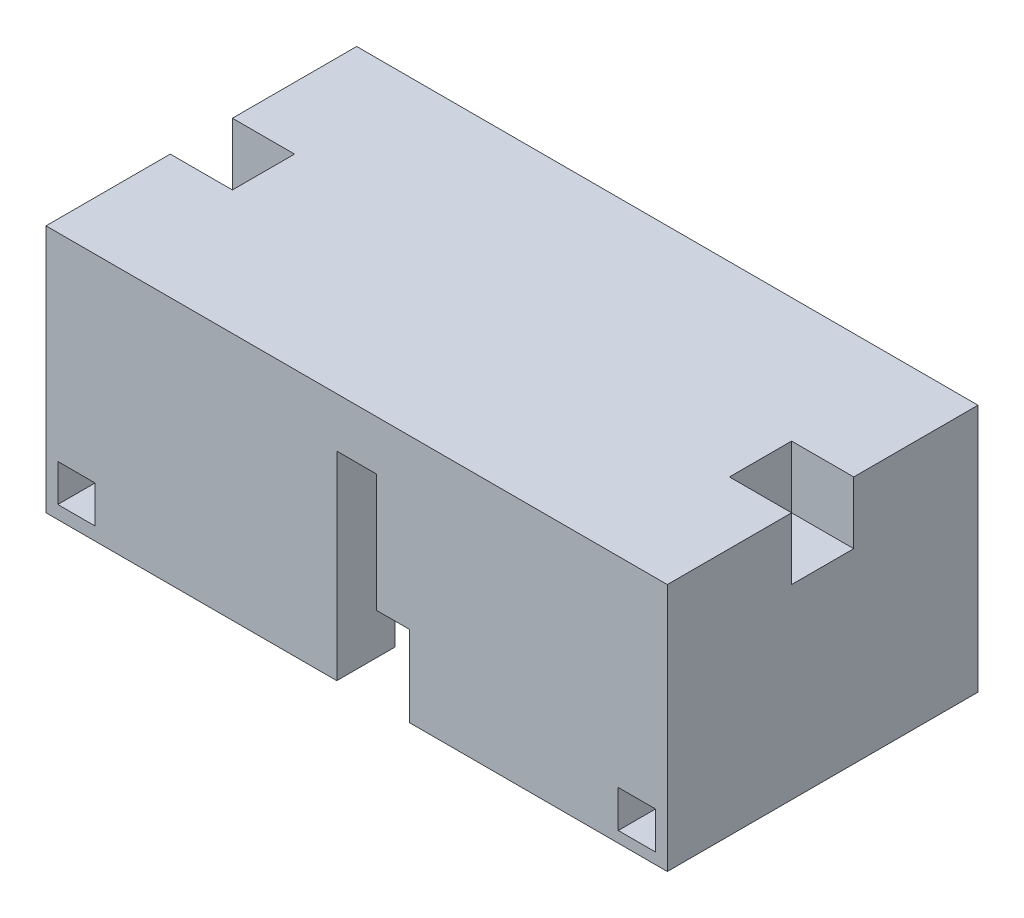
from build123d import *

# Parameters (mm, degrees)
SKETCH1_W                = 100
SKETCH1_H                = 100
BOSS_EXTRUDE1_DEPTH      = 50
BOSS_EXTRUDE4_DEPTH      = 50
BOSS_EXTRUDE4_2_DEPTH    = 50
SKETCH11_W               = 100
SKETCH11_H               = 50
CUT_EXTRUDE4_DEPTH       = 100
SKETCH13_W               = 100
SKETCH13_H               = 10
CUT_EXTRUDE5_DEPTH       = 50
SKETCH2_W                = 50
SKETCH2_H                = 50
CUT_EXTRUDE6_DEPTH       = 25
BOSS_EXTRUDE5_DEPTH      = 19.5
CUT_EXTRUDE7_DEPTH       = 12
CUT_EXTRUDE8_DEPTH       = 32
SKETCH27_W               = 6.4
SKETCH27_H               = 32
CUT_EXTRUDE9_DEPTH       = 29
SKETCH29_W               = 6
SKETCH29_H               = 3.5
CUT_EXTRUDE10_DEPTH      = 28
SKETCH30_W               = 100
SKETCH30_H               = 50
CUT_EXTRUDE11_DEPTH      = 45
SKETCH32_W               = 9.8
SKETCH32_H               = 9.8
BOSS_EXTRUDE6_DEPTH      = 9.8
CHAMFER1_SIZE            = 1
BOSS_EXTRUDE7_DEPTH      = 13
SKETCH34_3_W             = 9.7
SKETCH34_3_H             = 8.5
SKETCH34_3_W_2           = 0.5
SKETCH34_3_H_2           = 13.5
SKETCH34_3_H_3           = 16.6
SKETCH34_3_W_3           = 6
CUT_EXTRUDE12_DEPTH      = 13
CUT_EXTRUDE13_DEPTH      = 82.240384046
CUT_EXTRUDE13_DEPTH_BACK = 10
SKETCH36_W               = 10
SKETCH36_H               = 10
SKETCH37_W               = 9.8
SKETCH37_H               = 9.8
SKETCH37_H_2             = 10.048829857
CUT_EXTRUDE15_DEPTH      = 10
SKETCH38_W               = 6
SKETCH38_H               = 6
CUT_EXTRUDE16_DEPTH      = 6
SKETCH39_W               = 6.4
SKETCH39_H               = 16.6
CUT_EXTRUDE17_DEPTH      = 32
CUT_EXTRUDE18_DEPTH      = 13


with BuildPart() as part:
    # Sketch1 → Boss-Extrude1 (new body)
    with BuildSketch(Plane(origin=(0, 0, 0), x_dir=(1, 0, 0), z_dir=(0, 1, 0))):
        Rectangle(SKETCH1_W, SKETCH1_H)
    extrude(amount=-BOSS_EXTRUDE1_DEPTH)

    # Sketch13 → Cut-Extrude5 (cut)
    with BuildSketch(Plane(origin=(0, 0, -50), x_dir=(-1, 0, 0), z_dir=(0, 0, -1))):
        with Locations((0, -45)):
            Rectangle(SKETCH13_W, SKETCH13_H)
    extrude(amount=-CUT_EXTRUDE5_DEPTH, mode=Mode.SUBTRACT)

    # Sketch2 → Cut-Extrude6 (cut)
    with BuildSketch(Plane(origin=(0, 0, 0), x_dir=(1, 0, 0), z_dir=(0, 1, 0))):
        with Locations((-25, -25)):
            Rectangle(SKETCH2_W, SKETCH2_H)
        with Locations((25, -25)):
            Rectangle(SKETCH2_W, SKETCH2_H)
    extrude(amount=-CUT_EXTRUDE6_DEPTH, mode=Mode.SUBTRACT)

    # Sketch18 → Boss-Extrude5 (add)
    with BuildSketch(Plane(origin=(0, 0, 0), x_dir=(-1, 0, 0), z_dir=(0, 0, -1))):
        Polygon((50, -50), (50, -70), (30, -50), align=None)
        Polygon((-50, -50), (-50, -69.5), (-30.5, -50), align=None)
    extrude(amount=-BOSS_EXTRUDE5_DEPTH)

    # Sketch20 → Cut-Extrude7 (cut)
    with BuildSketch(Plane.XZ.offset(40)):
        Polygon((3.2, 0), (0, 0), (-30, 0), (-30, -22.9), (-14, -22.9), (-14, -27.9), (-11.1, -27.9), (-11.1, -22.9), (-7, -22.9), (-7, -14.9), (-2.8, -14.9), (3.2, -14.9), align=None)
    extrude(amount=-CUT_EXTRUDE7_DEPTH, mode=Mode.SUBTRACT)

    # Sketch21 → Cut-Extrude8 (cut)
    with BuildSketch(Plane.XZ.offset(40)):
        Polygon((3.2, 0), (0, 0), (-3.2, 0), (-3.2, -14.9), (3.2, -14.9), align=None)
    extrude(amount=-CUT_EXTRUDE8_DEPTH, mode=Mode.SUBTRACT)

    # Sketch27 → Cut-Extrude9 (cut)
    with BuildSketch(Plane(origin=(0, 0, 0), x_dir=(-1, 0, 0), z_dir=(0, 0, -1))):
        with Locations((0, -34)):
            Rectangle(SKETCH27_W, SKETCH27_H)
    extrude(amount=-CUT_EXTRUDE9_DEPTH, mode=Mode.SUBTRACT)

    # Sketch29 → Cut-Extrude10 (cut)
    with BuildSketch(Plane(origin=(0, 0, -50), x_dir=(-1, 0, 0), z_dir=(0, 0, -1))):
        Polygon((24, -34), (24, -36.5), (30, -36.5), (30, -31.5), (24, -31.5), align=None)
        with Locations((27, -38.25)):
            Rectangle(SKETCH29_W, SKETCH29_H)
    extrude(amount=-CUT_EXTRUDE10_DEPTH, mode=Mode.SUBTRACT)

    # Sketch30 → Cut-Extrude11 (cut)
    with BuildSketch(Plane(origin=(0, -25, 0), x_dir=(1, 0, 0), z_dir=(0, 1, 0))):
        with Locations((0, -25)):
            Rectangle(SKETCH30_W, SKETCH30_H)
    extrude(amount=-CUT_EXTRUDE11_DEPTH, mode=Mode.SUBTRACT)

    # Sketch32 → Boss-Extrude6 (add)
    with BuildSketch(Plane.XY):
        with Locations((-45.1, -35.1)):
            Rectangle(SKETCH32_W, SKETCH32_H)
        with Locations((45.1, -35.1)):
            Rectangle(SKETCH32_W, SKETCH32_H)
    extrude(amount=BOSS_EXTRUDE6_DEPTH)

    # Chamfer1
    chamfer1_edges = [part.edges().sort_by_distance(p)[0] for p in [
        (-40.2, -40, 4.9),
        (-40.2, -30.2, 4.9),
        (-40.2, -35.1, 9.8),
        (40.2, -30.2, 4.9),
        (40.2, -35.1, 9.8),
    ]]
    chamfer(chamfer1_edges, length=CHAMFER1_SIZE)

    # Sketch34 → Boss-Extrude7 (add)
    with BuildSketch(Plane.XZ.offset(40)):
        Polygon((-30, 0), (-30, -9.4), (-14.5, -9.4), (-14.5, -3.9), (-10.6, -3.9), (-10.6, -9.4), (-3.2, -9.4), (-3.2, 0), align=None)
    extrude(amount=-BOSS_EXTRUDE7_DEPTH)

    # Sketch34<3> → Cut-Extrude12 (cut)
    with BuildSketch(Plane.XZ.offset(40)):
        Polygon((3.2, -9.4), (3.2, -14.9), (3.2, -24.9), (8.5, -24.9), (8.5, 0), (3.2, 0), align=None)
        Polygon((-14, -27.9), (-11.1, -27.9), (-11.1, -22.9), (-7, -22.9), (-7, -14.9), (3.2, -14.9), (3.2, -9.4), (-3.2, -9.4), (-10.6, -9.4), (-10.6, -3.9), (-14.5, -3.9), (-14.5, -9.4), (-30, -9.4), (-30, -22.9), (-24, -22.9), (-14, -22.9), align=None)
        Polygon((-11.1, -22.9), (-11.1, -27.9), (-14, -27.9), (-14, -22.9), (-24, -22.9), (-24, -33.4), (-14.5, -33.4), (-14.5, -38.9), (-10.6, -38.9), (-10.6, -33.4), (-6.5, -33.4), (-6.5, -24.9), (3.2, -24.9), (3.2, -14.9), (-7, -14.9), (-7, -22.9), align=None)
        with Locations((-1.65, -29.15)):
            Rectangle(SKETCH34_3_W, SKETCH34_3_H)
        Polygon((-24, -33.4), (-24, -22.9), (-30, -22.9), (-30.5, -22.9), (-30.5, -33.4), (-30, -33.4), align=None)
        with Locations((-30.25, -16.15)):
            Rectangle(SKETCH34_3_W_2, SKETCH34_3_H_2)
        with Locations((-30.25, -41.7)):
            Rectangle(SKETCH34_3_W_2, SKETCH34_3_H_3)
        with Locations((-27, -41.7)):
            Rectangle(SKETCH34_3_W_3, SKETCH34_3_H_3)
    extrude(amount=-CUT_EXTRUDE12_DEPTH, mode=Mode.SUBTRACT)

    # Sketch36 → Cut-Extrude13 (cut, two sides: drawn at the far end of the back side and taken through both)
    with BuildSketch(Plane(origin=(0, 0, 0), x_dir=(1, 0, 0), z_dir=(0, 1, 0)).offset(-CUT_EXTRUDE13_DEPTH_BACK)):
        with Locations((-45, 25)):
            Rectangle(SKETCH36_W, SKETCH36_H)
        Polygon((50, 20), (50, 30), (40, 30), (40, 25), (40, 20), align=None)
    extrude(amount=CUT_EXTRUDE13_DEPTH + CUT_EXTRUDE13_DEPTH_BACK, mode=Mode.SUBTRACT)

    # Sketch37 → Cut-Extrude15 (cut)
    with BuildSketch(Plane.XZ.offset(40)):
        with Locations((-45.1, 4.9)):
            Rectangle(SKETCH37_W, SKETCH37_H)
        with Locations((45.1, 5.024414929)):
            Rectangle(SKETCH37_W, SKETCH37_H_2)
    extrude(amount=-CUT_EXTRUDE15_DEPTH, mode=Mode.SUBTRACT)

    # Sketch38 → Cut-Extrude16 (cut)
    with BuildSketch(Plane.XY):
        with Locations((-45.1, -34.890503426)):
            Rectangle(SKETCH38_W, SKETCH38_H)
        with Locations((45.1, -35.230904897)):
            Rectangle(SKETCH38_W, SKETCH38_H)
    extrude(amount=-CUT_EXTRUDE16_DEPTH, mode=Mode.SUBTRACT)

    # Sketch39 → Cut-Extrude17 (cut)
    with BuildSketch(Plane.XZ.offset(40)):
        with Locations((0, -41.7)):
            Rectangle(SKETCH39_W, SKETCH39_H)
        Polygon((3.2, -14.9), (-3.2, -14.9), (-3.2, -33.4), (3.2, -33.4), (3.2, -24.9), align=None)
    extrude(amount=-CUT_EXTRUDE17_DEPTH, mode=Mode.SUBTRACT)

    # Sketch34<4> → Cut-Extrude18 (cut)
    with BuildSketch(Plane.XZ.offset(40)):
        Polygon((8.5, -24.9), (3.2, -24.9), (3.2, -33.4), (3.2, -50), (8.5, -50), align=None)
    extrude(amount=-CUT_EXTRUDE18_DEPTH, mode=Mode.SUBTRACT)


with BuildPart() as body_2:
    # Sketch6 → Boss-Extrude4 (new body)
    with BuildSketch(Plane.XY.offset(50)):
        with BuildLine():
            Line((-1.9e-08, -50), (-50, -50))
            Line((-50, -50), (-50, -63.397459622))
            ThreePointArc((-50, -63.397459622), (-25.88190452, -53.407417374), (-1.9e-08, -50))
        make_face()
    extrude(amount=-BOSS_EXTRUDE4_DEPTH)


with BuildPart() as body_3:
    # Sketch6 → Boss-Extrude4 2 (new body)
    with BuildSketch(Plane.XY.offset(50)):
        with BuildLine():
            Line((50, -50), (-1.9e-08, -50))
            ThreePointArc((-1.9e-08, -50), (25.881904501, -53.407417369), (50, -63.397459622))
            Line((50, -63.397459622), (50, -50))
        make_face()
    extrude(amount=-BOSS_EXTRUDE4_2_DEPTH)


with BuildPart() as cut_extrude4_tool:
    # Sketch11 → Cut-Extrude4 (new body)
    with BuildSketch(Plane(origin=(0, -63.397459622, 0), x_dir=(-1, 0, 0), z_dir=(0, -1, 0))):
        with Locations((0, -25)):
            Rectangle(SKETCH11_W, SKETCH11_H)
    extrude(amount=-CUT_EXTRUDE4_DEPTH)


with BuildPart() as body_2_1:
    add(body_2.part)

    # Cut-Extrude4: cut by cut_extrude4_tool
    add(cut_extrude4_tool.part, mode=Mode.SUBTRACT)


with BuildPart() as body_3_1:
    add(body_3.part)

    # Cut-Extrude4: cut by cut_extrude4_tool
    add(cut_extrude4_tool.part, mode=Mode.SUBTRACT)


solid = part.part
